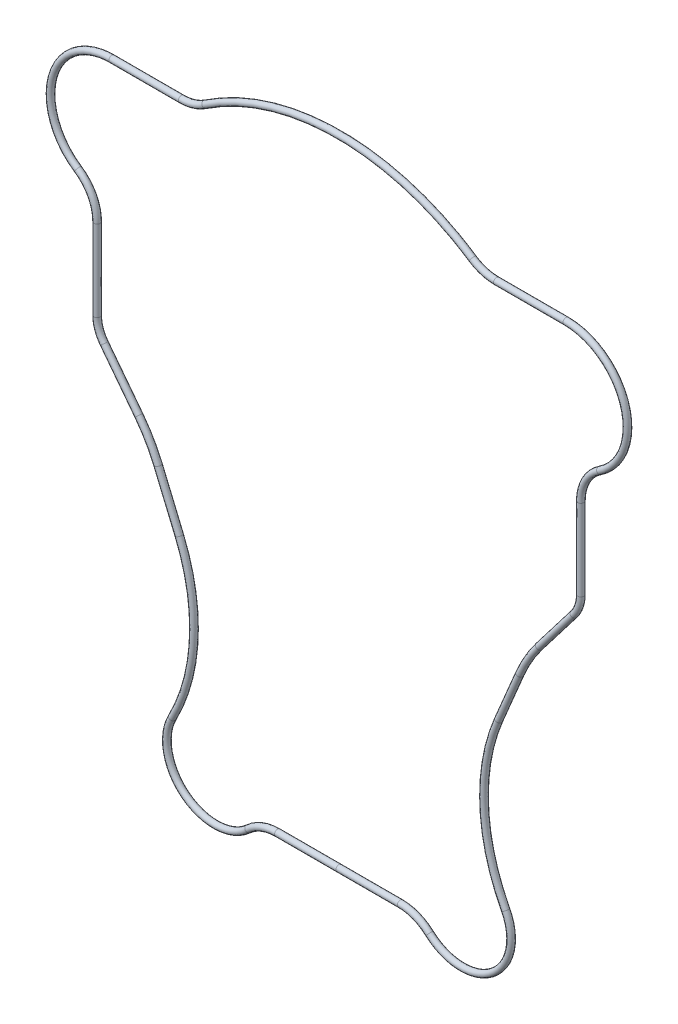
from build123d import *

# Parameters (mm, degrees)
SKETCH2_R = 1


with BuildPart() as part:
    # Sweep1: sweep along a path in Sketch1
    with BuildLine(Plane.XY) as sweep1_path:
        Line((-77.4, 14.282504671), (-77.4, -12))
        ThreePointArc((-77.4, -12), (-76.869301295, -15.214394653), (-75.333533403, -18.08761429))
        Line((-75.333533403, -18.08761429), (-64.139137996, -32.676434418))
        ThreePointArc((-64.139137996, -32.676434418), (-60.566879415, -38.008553695), (-57.707085562, -43.75434402))
        Line((-57.707085562, -43.75434402), (-50.868098956, -60.039092376))
        ThreePointArc((-50.868098956, -60.039092376), (-46.055703914, -86.839494641), (-53.113107106, -113.13804532))
        ThreePointArc((-53.113107106, -113.13804532), (-49.030719862, -131.725446634), (-30.017079041, -130.926174497))
        ThreePointArc((-30.017079041, -130.926174497), (-25.325699057, -128.015948682), (-19.899253745, -127))
        Line((-19.899253745, -127), (19.899253745, -127))
        ThreePointArc((19.899253745, -127), (25.325699057, -128.015948682), (30.017079041, -130.926174497))
        ThreePointArc((30.017079041, -130.926174497), (49.030719862, -131.725446634), (53.113107106, -113.13804532))
        ThreePointArc((53.113107106, -113.13804532), (46.055703914, -86.839494641), (50.868098956, -60.039092376))
        Line((50.868098956, -60.039092376), (57.707085562, -43.75434402))
        ThreePointArc((57.707085562, -43.75434402), (60.566879415, -38.008553695), (64.139137996, -32.676434418))
        Line((64.139137996, -32.676434418), (75.333533403, -18.08761429))
        ThreePointArc((75.333533403, -18.08761429), (76.869301295, -15.214394653), (77.4, -12))
        Line((77.4, -12), (77.4, 14.282504671))
        ThreePointArc((77.4, 14.282504671), (79.176950851, 21.364239713), (84.08679616, 26.768122073))
        ThreePointArc((84.08679616, 26.768122073), (91.702799067, 47.971631712), (73.612159322, 61.4))
        Line((73.612159322, 61.4), (51.074944934, 61.4))
        ThreePointArc((51.074944934, 61.4), (46.718980204, 62.046409116), (42.738446849, 63.92992383))
        ThreePointArc((42.738446849, 63.92992383), (0, 76.9), (-42.738446849, 63.92992383))
        ThreePointArc((-42.738446849, 63.92992383), (-46.718980204, 62.046409116), (-51.074944934, 61.4))
        Line((-51.074944934, 61.4), (-73.612159322, 61.4))
        ThreePointArc((-73.612159322, 61.4), (-91.702799067, 47.971631712), (-84.08679616, 26.768122073))
        ThreePointArc((-84.08679616, 26.768122073), (-79.176950851, 21.364239713), (-77.4, 14.282504671))
    # Sketch2 → Sweep1 (sweep)
    with BuildSketch(Plane(origin=(0, 0, 0), x_dir=(0, 0, -1), z_dir=(1, 0, 0))):
        with Locations((0, -128)):
            Circle(SKETCH2_R)
    sweep(path=sweep1_path.line)


solid = part.part
